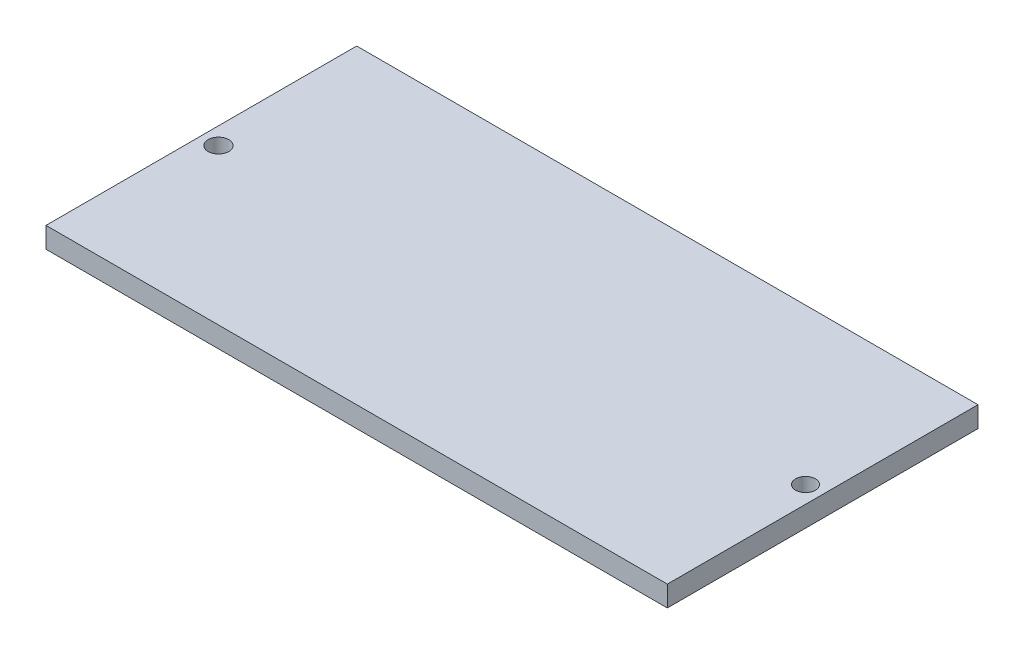
from build123d import *

# Parameters (mm, degrees)
SKETCH1_W                = 60.014675034
SKETCH1_H                = 30.010951808
BOSS_EXTRUDE3_DEPTH      = 2
SKETCH5_R                = 0.958101179
SKETCH5_R_2              = 1
CUT_EXTRUDE2_DEPTH       = 2
BOSS_EXTRUDE5_DEPTH      = 10
BOSS_EXTRUDE5_DEPTH_BACK = 10


with BuildPart() as part:
    # Sketch1 → Boss-Extrude3 (new body)
    with BuildSketch(Plane(origin=(0, 0, 0), x_dir=(1, 0, 0), z_dir=(0, 1, 0))):
        Rectangle(SKETCH1_W, SKETCH1_H)
    extrude(amount=BOSS_EXTRUDE3_DEPTH)

    # Sketch5 → Cut-Extrude2 (cut)
    with BuildSketch(Plane(origin=(0, 2, 0), x_dir=(1, 0, 0), z_dir=(0, 1, 0))):
        with Locations(Location((28.355534017, 0, 0), (0, 0, 270))):
            Circle(SKETCH5_R)
        with Locations(Location((-28.355534017, 0, 0), (0, 0, 270))):
            Circle(SKETCH5_R_2)
    extrude(amount=-CUT_EXTRUDE2_DEPTH, mode=Mode.SUBTRACT)

    # Sketch7 → Boss-Extrude5 (add, two sides: drawn at the far end of the back side and taken through both)
    with BuildSketch(Plane.XY.offset(-BOSS_EXTRUDE5_DEPTH_BACK)):
        Polygon((7.498773608, 0), (8.961948947, 0), (8.961948947, -3.176146278), (21.045388571, -3.176146278), (21.045388571, 0), (22.508563909, 0), (22.508563909, -4.517390338), (7.498773608, -4.517390338), align=None)
        Polygon((-7.498773608, 0), (-7.498773608, -4.517390338), (-22.508563909, -4.517390338), (-22.508563909, 0), (-21.045388571, 0), (-21.045388571, -3.176146278), (-8.961948947, -3.176146278), (-8.961948947, 0), align=None)
    extrude(amount=BOSS_EXTRUDE5_DEPTH + BOSS_EXTRUDE5_DEPTH_BACK)


solid = part.part
